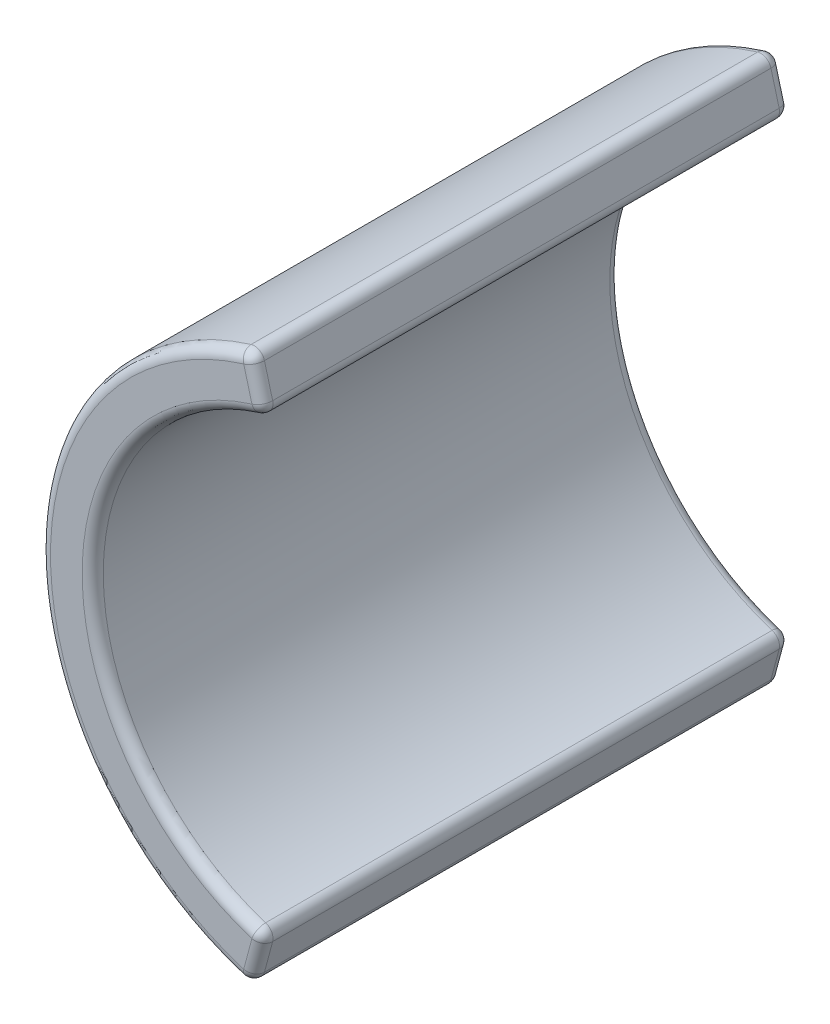
from build123d import *

# Parameters (mm, degrees)
SKETCH1_W      = 2.5
SKETCH1_H      = 25
REVOLVE1_ANGLE = 150
FILLET1_R      = 0.5


with BuildPart() as part:
    # Sketch1 → Revolve1 (revolve, symmetric)
    with BuildSketch(Plane(origin=(0, 0, 0), x_dir=(1, 0, 0), z_dir=(0, 1, 0))) as revolve1_sk:
        with Locations((-12.25, 0)):
            Rectangle(SKETCH1_W, SKETCH1_H)
    revolve(axis=Axis((0, 0, 0), (0, 0, -1)), revolution_arc=REVOLVE1_ANGLE / 2)
    revolve(revolve1_sk.sketch, axis=Axis((0, 0, 0), (0, 0, 1)), revolution_arc=REVOLVE1_ANGLE / 2)

    # Fillet1
    fillet1_edges = [part.edges().sort_by_distance(p)[0] for p in [
        (-2.847009496, 10.625184089, 0),
        (-3.170533303, 11.832591372, -12.5),
        (-3.170533303, -11.832591372, -12.5),
        (-3.494057109, -13.039998655, 0),
        (-3.170533303, -11.832591372, 12.5),
        (-3.494057109, 13.039998655, 0),
        (-2.847009496, -10.625184089, 0),
        (-13.5, 0, -12.5),
        (-11, 0, -12.5),
        (-11, 0, 12.5),
        (-13.5, 0, 12.5),
        (-3.170533303, 11.832591372, 12.5),
    ]]
    fillet(fillet1_edges, radius=FILLET1_R)


solid = part.part
